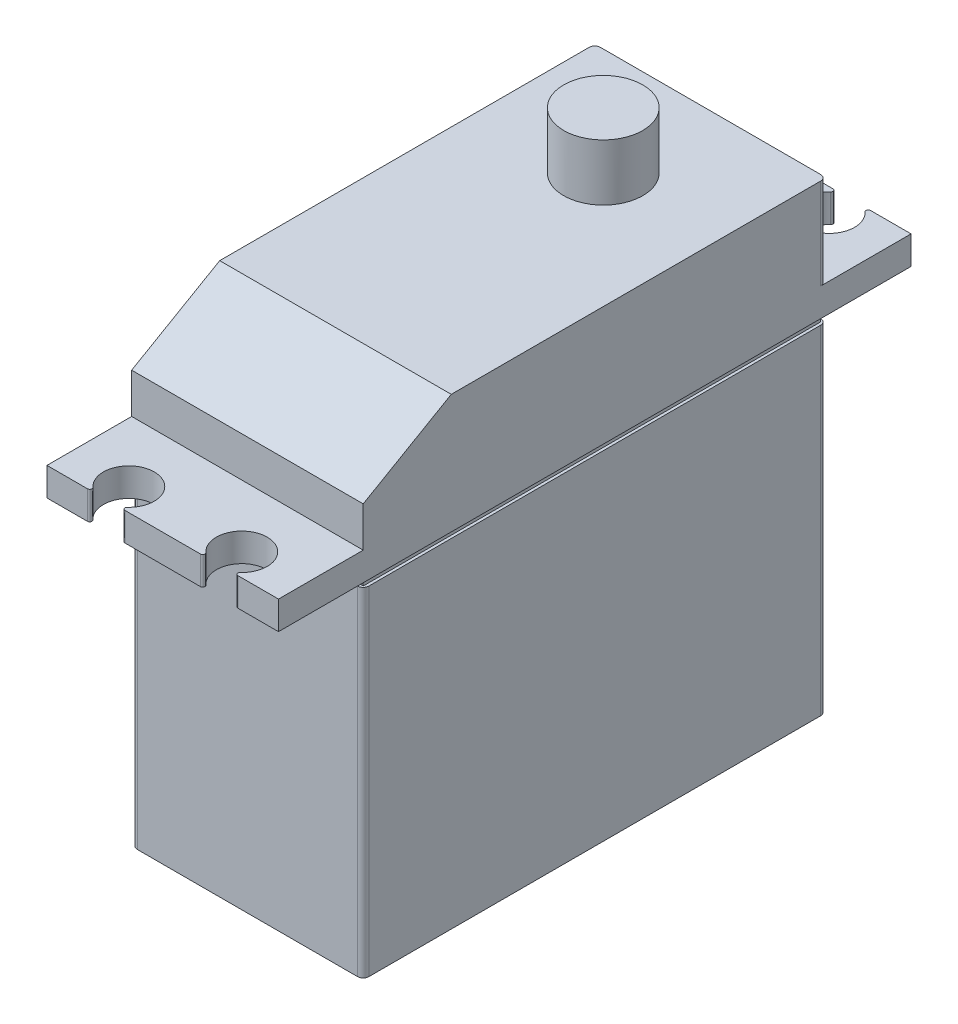
from build123d import *

# Parameters (mm, degrees)
SKETCH_1_W               = 20.5
SKETCH_1_H               = 41
EXTRUDE_1_DEPTH          = 20.5
SKETCH_2_W               = 0.5
SKETCH_2_H               = 0.5
CUT_EXTRUDE_1_DEPTH      = 31.75
SKETCH_3_W               = 0.5
SKETCH_3_H               = 0.5
CUT_EXTRUDE_2_DEPTH      = 31.75
SKETCH_4_W               = 7.5
SKETCH_4_H               = 2.5
EXTRUDE_2_DEPTH          = 10.25
SKETCH_5_R               = 2.25
CUT_EXTRUDE_3_DEPTH      = 45.438328051
FILLET_1_R               = 0.2
FILLET_1_OF_MIRROR_3_R   = 0.2
CUT_EXTRUDE_4_DEPTH      = 37.184423444
CUT_EXTRUDE_4_DEPTH_BACK = 37.184423444
FILLET_2_R               = 0.5
SKETCH_7_R               = 3.5
EXTRUDE_3_DEPTH          = 5


with BuildPart() as part:
    # 스케치1 → 보스-돌출1 (new, symmetric)
    with BuildSketch(Plane(origin=(0, 0, 0), x_dir=(1, 0, 0), z_dir=(0, 1, 0))):
        Rectangle(SKETCH_1_W, SKETCH_1_H)
    extrude(amount=EXTRUDE_1_DEPTH, both=True)

    # 스케치2 → 컷-돌출1 (cut, symmetric)
    with BuildSketch(Plane.XY):
        with Locations((-10.25, 9.7)):
            Rectangle(SKETCH_2_W, SKETCH_2_H)
    cut_extrude_1 = extrude(amount=CUT_EXTRUDE_1_DEPTH, both=True, mode=Mode.SUBTRACT)

    # 대칭 복사1: 컷-돌출1 across plane
    add(cut_extrude_1.mirror(Plane(origin=(0, 0, 0), x_dir=(0, 0, 1), z_dir=(1, 0, 0))), mode=Mode.SUBTRACT)

    # 스케치3 → 컷-돌출2 (cut, symmetric)
    with BuildSketch(Plane(origin=(0, 0, 0), x_dir=(0, 0, -1), z_dir=(1, 0, 0))):
        with Locations((-20.5, 9.7)):
            Rectangle(SKETCH_3_W, SKETCH_3_H)
    cut_extrude_2 = extrude(amount=CUT_EXTRUDE_2_DEPTH, both=True, mode=Mode.SUBTRACT)

    # 대칭 복사2: 컷-돌출2 across plane
    add(cut_extrude_2.mirror(Plane.XY), mode=Mode.SUBTRACT)

    # 스케치4 → 보스-돌출2 (add, symmetric)
    with BuildSketch(Plane(origin=(0, 0, 0), x_dir=(0, 0, -1), z_dir=(1, 0, 0))):
        with Locations((24.25, 11.2)):
            Rectangle(SKETCH_4_W, SKETCH_4_H)
    extrude_2 = extrude(amount=EXTRUDE_2_DEPTH, both=True)

    # 스케치5 → 컷-돌출3 (cut, symmetric)
    with BuildSketch(Plane(origin=(0, 12.45, 0), x_dir=(1, 0, 0), z_dir=(0, 1, 0))):
        with Locations((5, 26)):
            Circle(SKETCH_5_R)
        with Locations((-5, 26)):
            Circle(SKETCH_5_R)
    cut_extrude_3 = extrude(amount=CUT_EXTRUDE_3_DEPTH, both=True, mode=Mode.SUBTRACT)

    # 필렛1
    fillet_1_edges = [part.edges().sort_by_distance(p)[0] for p in [
        (3.969223594, 11.2, -28),
        (6.030776406, 11.2, -28),
        (-6.030776406, 11.2, -28),
        (-3.969223594, 11.2, -28),
    ]]
    fillet(fillet_1_edges, radius=FILLET_1_R)

    # 대칭 복사3: 보스-돌출2, 컷-돌출3 across plane
    add(extrude_2.mirror(Plane.XY))
    add(cut_extrude_3.mirror(Plane.XY), mode=Mode.SUBTRACT)

    # 필렛1 of 대칭 복사3
    fillet_1_of_mirror_3_edges = [part.edges().sort_by_distance(p)[0] for p in [
        (3.969223594, 11.2, 28),
        (6.030776406, 11.2, 28),
        (-6.030776406, 11.2, 28),
        (-3.969223594, 11.2, 28),
    ]]
    fillet(fillet_1_of_mirror_3_edges, radius=FILLET_1_OF_MIRROR_3_R)

    # 스케치6 → 컷-돌출4 (cut, two sides: drawn at the far end of the back side and taken through both)
    with BuildSketch(Plane(origin=(0, 0, 0), x_dir=(0, 0, -1), z_dir=(1, 0, 0)).offset(-CUT_EXTRUDE_4_DEPTH_BACK)):
        Polygon((-20.5, 16), (-20.5, 20.5), (-12.705771366, 20.5), align=None)
    extrude(amount=CUT_EXTRUDE_4_DEPTH + CUT_EXTRUDE_4_DEPTH_BACK, mode=Mode.SUBTRACT)

    # 필렛2
    fillet_2_edges = [part.edges().sort_by_distance(p)[0] for p in [
        (-10.25, -5.525, 20.5),
        (-10.25, -5.525, -20.5),
        (10.25, -5.525, 20.5),
        (10.25, -5.525, -20.5),
        (-10.25, 16.475, -20.5),
        (10.25, 16.475, -20.5),
    ]]
    fillet(fillet_2_edges, radius=FILLET_2_R)

    # 스케치7 → 보스-돌출3 (add)
    with BuildSketch(Plane(origin=(0, 20.5, 0), x_dir=(1, 0, 0), z_dir=(0, 1, 0))):
        with Locations(Location((0, 11, 0), (0, 0, 90))):
            Circle(SKETCH_7_R)
    extrude(amount=EXTRUDE_3_DEPTH)


solid = part.part
